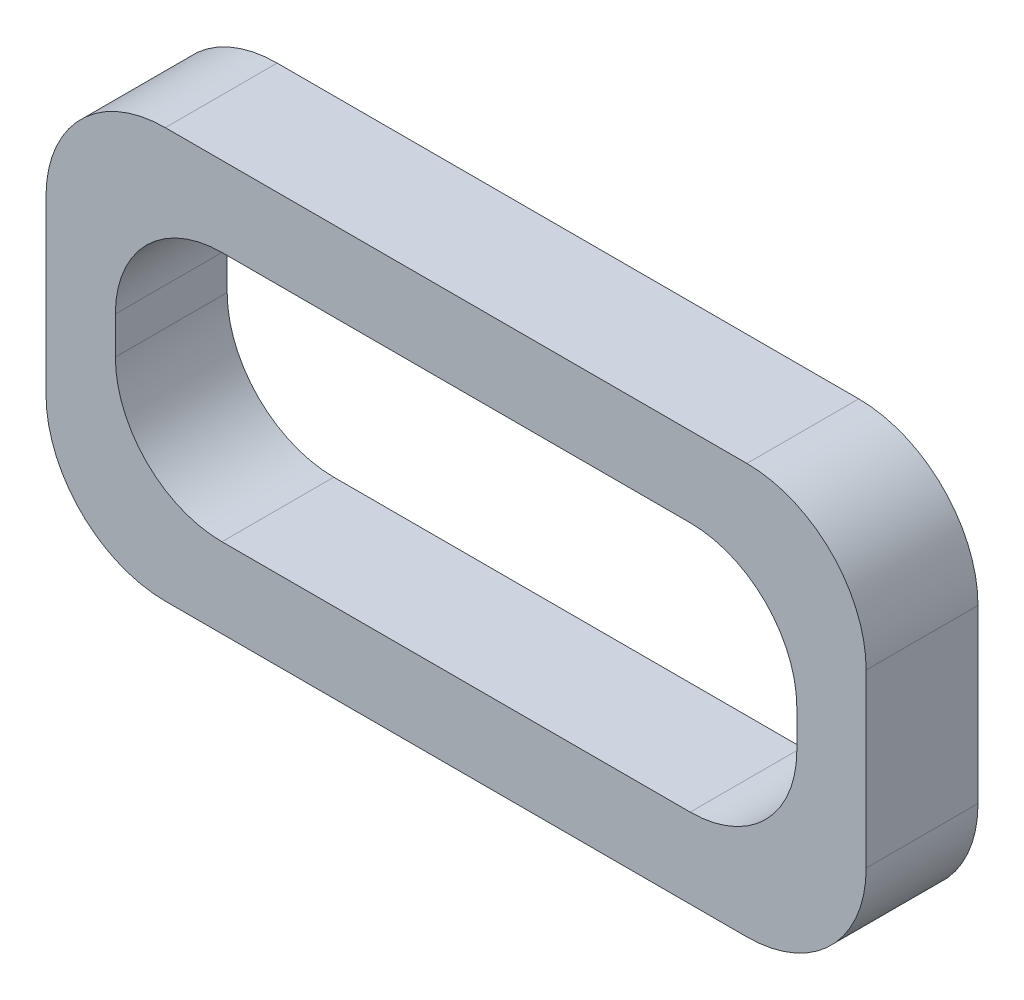
from build123d import *

# Parameters (mm, degrees)
BOSS_EXTRUDE1_DEPTH = 1.5


with BuildPart() as part:
    # Sketch1 → Boss-Extrude1 (new body)
    with BuildSketch(Plane.XY):
        with BuildLine():
            Line((-3.9, -2.75), (3.9, -2.75))
            ThreePointArc((3.9, -2.75), (5.03137085, -2.28137085), (5.5, -1.15))
            Line((5.5, -1.15), (5.5, 1.15))
            ThreePointArc((5.5, 1.15), (5.03137085, 2.28137085), (3.9, 2.75))
            Line((3.9, 2.75), (-3.9, 2.75))
            ThreePointArc((-3.9, 2.75), (-5.03137085, 2.28137085), (-5.5, 1.15))
            Line((-5.5, 1.15), (-5.5, -1.15))
            ThreePointArc((-5.5, -1.15), (-5.03137085, -2.28137085), (-3.9, -2.75))
        make_face()
        with BuildLine():
            Line((4.57, -0.25), (4.57, 0.25))
            ThreePointArc((4.57, 0.25), (4.151162697, 1.261162697), (3.14, 1.68))
            Line((3.14, 1.68), (-3.14, 1.68))
            ThreePointArc((-3.14, 1.68), (-4.151162697, 1.261162697), (-4.57, 0.25))
            Line((-4.57, 0.25), (-4.57, -0.25))
            ThreePointArc((-4.57, -0.25), (-4.151162697, -1.261162697), (-3.14, -1.68))
            Line((-3.14, -1.68), (3.14, -1.68))
            ThreePointArc((3.14, -1.68), (4.151162697, -1.261162697), (4.57, -0.25))
        make_face(mode=Mode.SUBTRACT)
    extrude(amount=BOSS_EXTRUDE1_DEPTH)


solid = part.part
